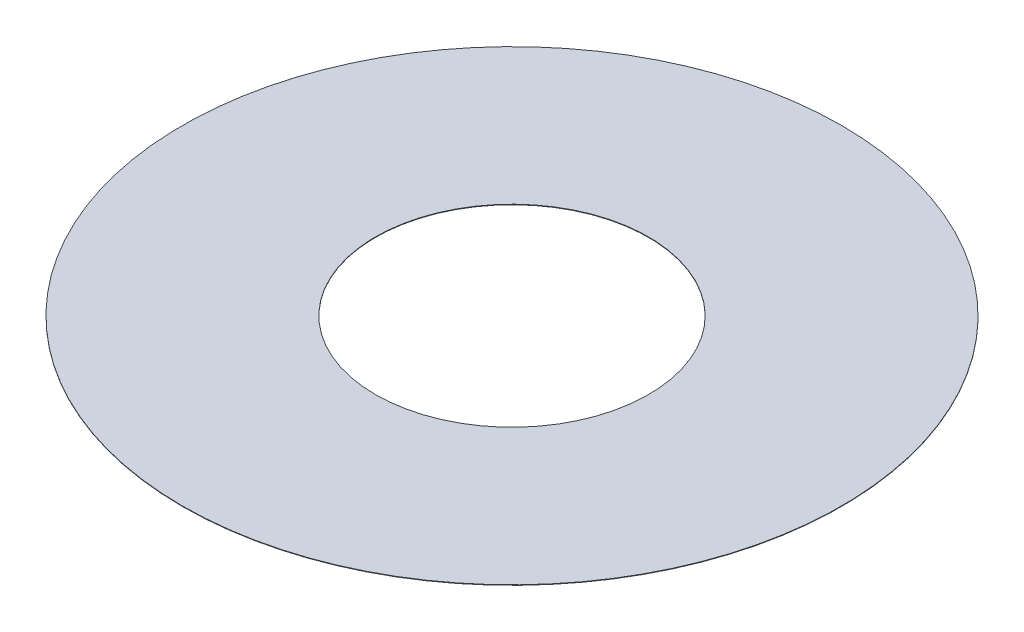
from build123d import *

# Parameters (mm, degrees)
SKETCH1_R           = 152
BOSS_EXTRUDE1_DEPTH = 0.225
SKETCH2_R           = 63
CUT_EXTRUDE1_DEPTH  = 0.225


with BuildPart() as part:
    # Sketch1 → Boss-Extrude1 (new body)
    with BuildSketch(Plane(origin=(0, 0, 0), x_dir=(1, 0, 0), z_dir=(0, 1, 0))):
        with Locations(Location((0, 0, 0), (0, 0, 270))):
            Circle(SKETCH1_R)
    extrude(amount=BOSS_EXTRUDE1_DEPTH)

    # Sketch2 → Cut-Extrude1 (cut)
    with BuildSketch(Plane(origin=(0, 0.225, 0), x_dir=(1, 0, 0), z_dir=(0, 1, 0))):
        with Locations(Location((0, 0, 0), (0, 0, 270))):
            Circle(SKETCH2_R)
    extrude(amount=-CUT_EXTRUDE1_DEPTH, mode=Mode.SUBTRACT)


solid = part.part
